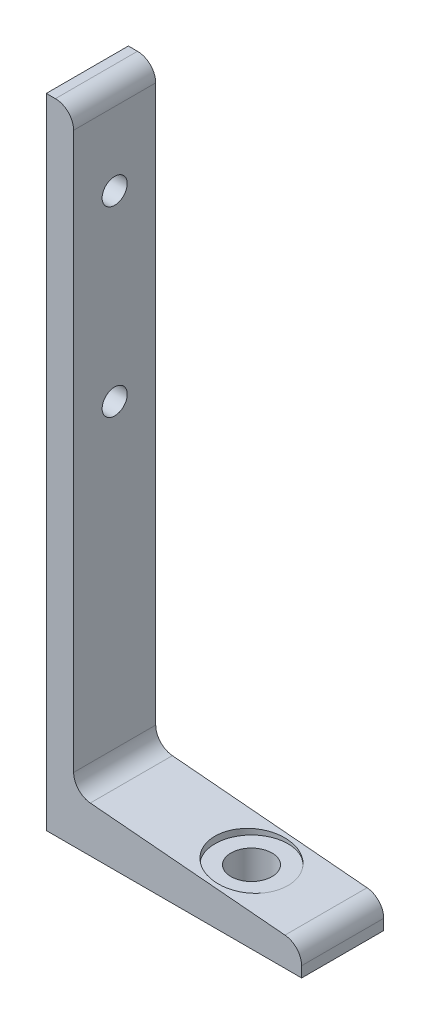
from build123d import *

# Parameters (mm, degrees)
BOSS_EXTRUDE1_DEPTH = 9
SKETCH2_R           = 4.5
CUT_EXTRUDE1_DEPTH  = 152.052970841
CUT_EXTRUDE2_START  = 7
SKETCH3_R           = 8
CUT_EXTRUDE2_DEPTH  = 145.052970841
SKETCH4_R           = 2.75
CUT_EXTRUDE3_DEPTH  = 152.052970841


with BuildPart() as part:
    # Sketch1 → Boss-Extrude1 (new, symmetric)
    with BuildSketch(Plane.XY):
        with BuildLine():
            Line((0, 0), (0, 140))
            Line((0, 140), (2, 140))
            ThreePointArc((2, 140), (4.828427125, 138.828427125), (6, 136))
            Line((6, 136), (6, 14.039757872))
            ThreePointArc((6, 14.039757872), (7.050890653, 11.337397042), (9.651377029, 10.05497908))
            Line((9.651377029, 10.05497908), (52.348622971, 6.319454096))
            ThreePointArc((52.348622971, 6.319454096), (54.949109347, 5.037036134), (56, 2.334675304))
            Line((56, 2.334675304), (56, 0))
            Line((56, 0), (0, 0))
        make_face()
    extrude(amount=BOSS_EXTRUDE1_DEPTH, both=True)

    # Sketch2 → Cut-Extrude1 (cut, through all)
    with BuildSketch(Plane(origin=(0, 0, 0), x_dir=(1, 0, 0), z_dir=(0, 1, 0))):
        with Locations((36, 0)):
            Circle(SKETCH2_R)
    extrude(amount=CUT_EXTRUDE1_DEPTH, mode=Mode.SUBTRACT)

    # Sketch3 → Cut-Extrude2 (cut, through all)
    with BuildSketch(Plane(origin=(0, 0, 0), x_dir=(1, 0, 0), z_dir=(0, 1, 0)).offset(CUT_EXTRUDE2_START)):
        with Locations((36, 0)):
            Circle(SKETCH3_R)
    extrude(amount=CUT_EXTRUDE2_DEPTH, mode=Mode.SUBTRACT)

    # Sketch4 → Cut-Extrude3 (cut, through all)
    with BuildSketch(Plane(origin=(0, 0, 0), x_dir=(0, 0, -1), z_dir=(1, 0, 0))):
        with Locations(Location((0, 80, 0), (0, 0, 270))):
            Circle(SKETCH4_R)
        with Locations(Location((0, 120, 0), (0, 0, 270))):
            Circle(SKETCH4_R)
    extrude(amount=CUT_EXTRUDE3_DEPTH, mode=Mode.SUBTRACT)


solid = part.part
